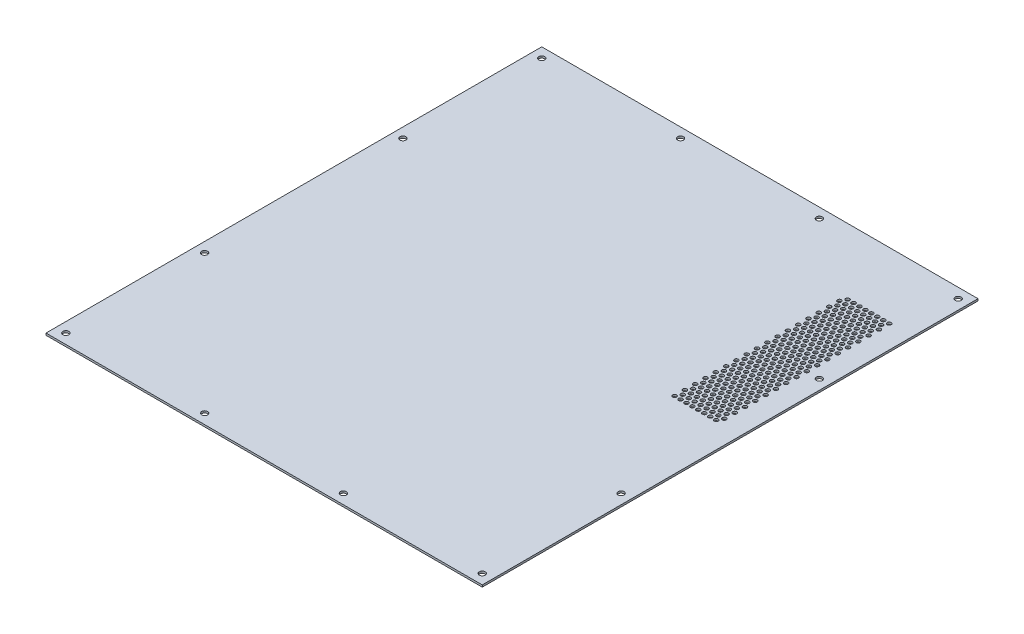
from build123d import *

# Parameters (mm, degrees)
SKETCH1_W           = 440
SKETCH1_H           = 500
SKETCH1_R           = 2
SKETCH1_R_2         = 3
BOSS_EXTRUDE1_DEPTH = 2


with BuildPart() as part:
    # Sketch1 → Boss-Extrude1 (new body)
    with BuildSketch(Plane(origin=(0, 0, 0), x_dir=(1, 0, 0), z_dir=(0, 1, 0))):
        with Locations((220, 250)):
            Rectangle(SKETCH1_W, SKETCH1_H)
        with Locations(Location((372, 262, 0), (0, 0, 270))):
            Circle(SKETCH1_R, mode=Mode.SUBTRACT)
        with Locations(Location((375, 267.196152423, 0), (0, 0, 270))):
            Circle(SKETCH1_R, mode=Mode.SUBTRACT)
        with Locations(Location((381, 267.196152423, 0), (0, 0, 270))):
            Circle(SKETCH1_R, mode=Mode.SUBTRACT)
        with Locations(Location((378, 262, 0), (0, 0, 270))):
            Circle(SKETCH1_R, mode=Mode.SUBTRACT)
        with Locations(Location((387, 267.196152423, 0), (0, 0, 270))):
            Circle(SKETCH1_R, mode=Mode.SUBTRACT)
        with Locations(Location((384, 262, 0), (0, 0, 270))):
            Circle(SKETCH1_R, mode=Mode.SUBTRACT)
        with Locations(Location((393, 267.196152423, 0), (0, 0, 270))):
            Circle(SKETCH1_R, mode=Mode.SUBTRACT)
        with Locations(Location((390, 262, 0), (0, 0, 270))):
            Circle(SKETCH1_R, mode=Mode.SUBTRACT)
        with Locations(Location((399, 267.196152423, 0), (0, 0, 270))):
            Circle(SKETCH1_R, mode=Mode.SUBTRACT)
        with Locations(Location((396, 262, 0), (0, 0, 270))):
            Circle(SKETCH1_R, mode=Mode.SUBTRACT)
        with Locations(Location((405, 267.196152423, 0), (0, 0, 270))):
            Circle(SKETCH1_R, mode=Mode.SUBTRACT)
        with Locations(Location((402, 262, 0), (0, 0, 270))):
            Circle(SKETCH1_R, mode=Mode.SUBTRACT)
        with Locations(Location((411, 267.196152423, 0), (0, 0, 270))):
            Circle(SKETCH1_R, mode=Mode.SUBTRACT)
        with Locations(Location((408, 262, 0), (0, 0, 270))):
            Circle(SKETCH1_R, mode=Mode.SUBTRACT)
        with Locations(Location((417, 267.196152423, 0), (0, 0, 270))):
            Circle(SKETCH1_R, mode=Mode.SUBTRACT)
        with Locations(Location((414, 262, 0), (0, 0, 270))):
            Circle(SKETCH1_R, mode=Mode.SUBTRACT)
        with Locations(Location((381, 277.586152423, 0), (0, 0, 270))):
            Circle(SKETCH1_R, mode=Mode.SUBTRACT)
        with Locations(Location((378, 272.39, 0), (0, 0, 270))):
            Circle(SKETCH1_R, mode=Mode.SUBTRACT)
        with Locations(Location((387, 277.586152423, 0), (0, 0, 270))):
            Circle(SKETCH1_R, mode=Mode.SUBTRACT)
        with Locations(Location((384, 272.39, 0), (0, 0, 270))):
            Circle(SKETCH1_R, mode=Mode.SUBTRACT)
        with Locations(Location((393, 277.586152423, 0), (0, 0, 270))):
            Circle(SKETCH1_R, mode=Mode.SUBTRACT)
        with Locations(Location((390, 272.39, 0), (0, 0, 270))):
            Circle(SKETCH1_R, mode=Mode.SUBTRACT)
        with Locations(Location((399, 277.586152423, 0), (0, 0, 270))):
            Circle(SKETCH1_R, mode=Mode.SUBTRACT)
        with Locations(Location((396, 272.39, 0), (0, 0, 270))):
            Circle(SKETCH1_R, mode=Mode.SUBTRACT)
        with Locations(Location((405, 277.586152423, 0), (0, 0, 270))):
            Circle(SKETCH1_R, mode=Mode.SUBTRACT)
        with Locations(Location((402, 272.39, 0), (0, 0, 270))):
            Circle(SKETCH1_R, mode=Mode.SUBTRACT)
        with Locations(Location((411, 277.586152423, 0), (0, 0, 270))):
            Circle(SKETCH1_R, mode=Mode.SUBTRACT)
        with Locations(Location((408, 272.39, 0), (0, 0, 270))):
            Circle(SKETCH1_R, mode=Mode.SUBTRACT)
        with Locations(Location((417, 277.586152423, 0), (0, 0, 270))):
            Circle(SKETCH1_R, mode=Mode.SUBTRACT)
        with Locations(Location((414, 272.39, 0), (0, 0, 270))):
            Circle(SKETCH1_R, mode=Mode.SUBTRACT)
        with Locations(Location((381, 287.976152423, 0), (0, 0, 270))):
            Circle(SKETCH1_R, mode=Mode.SUBTRACT)
        with Locations(Location((378, 282.78, 0), (0, 0, 270))):
            Circle(SKETCH1_R, mode=Mode.SUBTRACT)
        with Locations(Location((387, 287.976152423, 0), (0, 0, 270))):
            Circle(SKETCH1_R, mode=Mode.SUBTRACT)
        with Locations(Location((384, 282.78, 0), (0, 0, 270))):
            Circle(SKETCH1_R, mode=Mode.SUBTRACT)
        with Locations(Location((393, 287.976152423, 0), (0, 0, 270))):
            Circle(SKETCH1_R, mode=Mode.SUBTRACT)
        with Locations(Location((390, 282.78, 0), (0, 0, 270))):
            Circle(SKETCH1_R, mode=Mode.SUBTRACT)
        with Locations(Location((399, 287.976152423, 0), (0, 0, 270))):
            Circle(SKETCH1_R, mode=Mode.SUBTRACT)
        with Locations(Location((396, 282.78, 0), (0, 0, 270))):
            Circle(SKETCH1_R, mode=Mode.SUBTRACT)
        with Locations(Location((405, 287.976152423, 0), (0, 0, 270))):
            Circle(SKETCH1_R, mode=Mode.SUBTRACT)
        with Locations(Location((402, 282.78, 0), (0, 0, 270))):
            Circle(SKETCH1_R, mode=Mode.SUBTRACT)
        with Locations(Location((411, 287.976152423, 0), (0, 0, 270))):
            Circle(SKETCH1_R, mode=Mode.SUBTRACT)
        with Locations(Location((408, 282.78, 0), (0, 0, 270))):
            Circle(SKETCH1_R, mode=Mode.SUBTRACT)
        with Locations(Location((417, 287.976152423, 0), (0, 0, 270))):
            Circle(SKETCH1_R, mode=Mode.SUBTRACT)
        with Locations(Location((414, 282.78, 0), (0, 0, 270))):
            Circle(SKETCH1_R, mode=Mode.SUBTRACT)
        with Locations(Location((381, 298.366152423, 0), (0, 0, 270))):
            Circle(SKETCH1_R, mode=Mode.SUBTRACT)
        with Locations(Location((378, 293.17, 0), (0, 0, 270))):
            Circle(SKETCH1_R, mode=Mode.SUBTRACT)
        with Locations(Location((387, 298.366152423, 0), (0, 0, 270))):
            Circle(SKETCH1_R, mode=Mode.SUBTRACT)
        with Locations(Location((384, 293.17, 0), (0, 0, 270))):
            Circle(SKETCH1_R, mode=Mode.SUBTRACT)
        with Locations(Location((393, 298.366152423, 0), (0, 0, 270))):
            Circle(SKETCH1_R, mode=Mode.SUBTRACT)
        with Locations(Location((390, 293.17, 0), (0, 0, 270))):
            Circle(SKETCH1_R, mode=Mode.SUBTRACT)
        with Locations(Location((399, 298.366152423, 0), (0, 0, 270))):
            Circle(SKETCH1_R, mode=Mode.SUBTRACT)
        with Locations(Location((396, 293.17, 0), (0, 0, 270))):
            Circle(SKETCH1_R, mode=Mode.SUBTRACT)
        with Locations(Location((405, 298.366152423, 0), (0, 0, 270))):
            Circle(SKETCH1_R, mode=Mode.SUBTRACT)
        with Locations(Location((402, 293.17, 0), (0, 0, 270))):
            Circle(SKETCH1_R, mode=Mode.SUBTRACT)
        with Locations(Location((411, 298.366152423, 0), (0, 0, 270))):
            Circle(SKETCH1_R, mode=Mode.SUBTRACT)
        with Locations(Location((408, 293.17, 0), (0, 0, 270))):
            Circle(SKETCH1_R, mode=Mode.SUBTRACT)
        with Locations(Location((417, 298.366152423, 0), (0, 0, 270))):
            Circle(SKETCH1_R, mode=Mode.SUBTRACT)
        with Locations(Location((414, 293.17, 0), (0, 0, 270))):
            Circle(SKETCH1_R, mode=Mode.SUBTRACT)
        with Locations(Location((381, 308.756152423, 0), (0, 0, 270))):
            Circle(SKETCH1_R, mode=Mode.SUBTRACT)
        with Locations(Location((378, 303.56, 0), (0, 0, 270))):
            Circle(SKETCH1_R, mode=Mode.SUBTRACT)
        with Locations(Location((387, 308.756152423, 0), (0, 0, 270))):
            Circle(SKETCH1_R, mode=Mode.SUBTRACT)
        with Locations(Location((384, 303.56, 0), (0, 0, 270))):
            Circle(SKETCH1_R, mode=Mode.SUBTRACT)
        with Locations(Location((393, 308.756152423, 0), (0, 0, 270))):
            Circle(SKETCH1_R, mode=Mode.SUBTRACT)
        with Locations(Location((390, 303.56, 0), (0, 0, 270))):
            Circle(SKETCH1_R, mode=Mode.SUBTRACT)
        with Locations(Location((399, 308.756152423, 0), (0, 0, 270))):
            Circle(SKETCH1_R, mode=Mode.SUBTRACT)
        with Locations(Location((396, 303.56, 0), (0, 0, 270))):
            Circle(SKETCH1_R, mode=Mode.SUBTRACT)
        with Locations(Location((405, 308.756152423, 0), (0, 0, 270))):
            Circle(SKETCH1_R, mode=Mode.SUBTRACT)
        with Locations(Location((402, 303.56, 0), (0, 0, 270))):
            Circle(SKETCH1_R, mode=Mode.SUBTRACT)
        with Locations(Location((411, 308.756152423, 0), (0, 0, 270))):
            Circle(SKETCH1_R, mode=Mode.SUBTRACT)
        with Locations(Location((408, 303.56, 0), (0, 0, 270))):
            Circle(SKETCH1_R, mode=Mode.SUBTRACT)
        with Locations(Location((417, 308.756152423, 0), (0, 0, 270))):
            Circle(SKETCH1_R, mode=Mode.SUBTRACT)
        with Locations(Location((414, 303.56, 0), (0, 0, 270))):
            Circle(SKETCH1_R, mode=Mode.SUBTRACT)
        with Locations(Location((381, 319.146152423, 0), (0, 0, 270))):
            Circle(SKETCH1_R, mode=Mode.SUBTRACT)
        with Locations(Location((378, 313.95, 0), (0, 0, 270))):
            Circle(SKETCH1_R, mode=Mode.SUBTRACT)
        with Locations(Location((387, 319.146152423, 0), (0, 0, 270))):
            Circle(SKETCH1_R, mode=Mode.SUBTRACT)
        with Locations(Location((384, 313.95, 0), (0, 0, 270))):
            Circle(SKETCH1_R, mode=Mode.SUBTRACT)
        with Locations(Location((393, 319.146152423, 0), (0, 0, 270))):
            Circle(SKETCH1_R, mode=Mode.SUBTRACT)
        with Locations(Location((390, 313.95, 0), (0, 0, 270))):
            Circle(SKETCH1_R, mode=Mode.SUBTRACT)
        with Locations(Location((399, 319.146152423, 0), (0, 0, 270))):
            Circle(SKETCH1_R, mode=Mode.SUBTRACT)
        with Locations(Location((396, 313.95, 0), (0, 0, 270))):
            Circle(SKETCH1_R, mode=Mode.SUBTRACT)
        with Locations(Location((405, 319.146152423, 0), (0, 0, 270))):
            Circle(SKETCH1_R, mode=Mode.SUBTRACT)
        with Locations(Location((402, 313.95, 0), (0, 0, 270))):
            Circle(SKETCH1_R, mode=Mode.SUBTRACT)
        with Locations(Location((411, 319.146152423, 0), (0, 0, 270))):
            Circle(SKETCH1_R, mode=Mode.SUBTRACT)
        with Locations(Location((408, 313.95, 0), (0, 0, 270))):
            Circle(SKETCH1_R, mode=Mode.SUBTRACT)
        with Locations(Location((417, 319.146152423, 0), (0, 0, 270))):
            Circle(SKETCH1_R, mode=Mode.SUBTRACT)
        with Locations(Location((414, 313.95, 0), (0, 0, 270))):
            Circle(SKETCH1_R, mode=Mode.SUBTRACT)
        with Locations(Location((381, 329.536152423, 0), (0, 0, 270))):
            Circle(SKETCH1_R, mode=Mode.SUBTRACT)
        with Locations(Location((378, 324.34, 0), (0, 0, 270))):
            Circle(SKETCH1_R, mode=Mode.SUBTRACT)
        with Locations(Location((387, 329.536152423, 0), (0, 0, 270))):
            Circle(SKETCH1_R, mode=Mode.SUBTRACT)
        with Locations(Location((384, 324.34, 0), (0, 0, 270))):
            Circle(SKETCH1_R, mode=Mode.SUBTRACT)
        with Locations(Location((393, 329.536152423, 0), (0, 0, 270))):
            Circle(SKETCH1_R, mode=Mode.SUBTRACT)
        with Locations(Location((390, 324.34, 0), (0, 0, 270))):
            Circle(SKETCH1_R, mode=Mode.SUBTRACT)
        with Locations(Location((399, 329.536152423, 0), (0, 0, 270))):
            Circle(SKETCH1_R, mode=Mode.SUBTRACT)
        with Locations(Location((396, 324.34, 0), (0, 0, 270))):
            Circle(SKETCH1_R, mode=Mode.SUBTRACT)
        with Locations(Location((405, 329.536152423, 0), (0, 0, 270))):
            Circle(SKETCH1_R, mode=Mode.SUBTRACT)
        with Locations(Location((402, 324.34, 0), (0, 0, 270))):
            Circle(SKETCH1_R, mode=Mode.SUBTRACT)
        with Locations(Location((411, 329.536152423, 0), (0, 0, 270))):
            Circle(SKETCH1_R, mode=Mode.SUBTRACT)
        with Locations(Location((408, 324.34, 0), (0, 0, 270))):
            Circle(SKETCH1_R, mode=Mode.SUBTRACT)
        with Locations(Location((417, 329.536152423, 0), (0, 0, 270))):
            Circle(SKETCH1_R, mode=Mode.SUBTRACT)
        with Locations(Location((414, 324.34, 0), (0, 0, 270))):
            Circle(SKETCH1_R, mode=Mode.SUBTRACT)
        with Locations(Location((381, 339.926152423, 0), (0, 0, 270))):
            Circle(SKETCH1_R, mode=Mode.SUBTRACT)
        with Locations(Location((378, 334.73, 0), (0, 0, 270))):
            Circle(SKETCH1_R, mode=Mode.SUBTRACT)
        with Locations(Location((387, 339.926152423, 0), (0, 0, 270))):
            Circle(SKETCH1_R, mode=Mode.SUBTRACT)
        with Locations(Location((384, 334.73, 0), (0, 0, 270))):
            Circle(SKETCH1_R, mode=Mode.SUBTRACT)
        with Locations(Location((393, 339.926152423, 0), (0, 0, 270))):
            Circle(SKETCH1_R, mode=Mode.SUBTRACT)
        with Locations(Location((390, 334.73, 0), (0, 0, 270))):
            Circle(SKETCH1_R, mode=Mode.SUBTRACT)
        with Locations(Location((399, 339.926152423, 0), (0, 0, 270))):
            Circle(SKETCH1_R, mode=Mode.SUBTRACT)
        with Locations(Location((396, 334.73, 0), (0, 0, 270))):
            Circle(SKETCH1_R, mode=Mode.SUBTRACT)
        with Locations(Location((405, 339.926152423, 0), (0, 0, 270))):
            Circle(SKETCH1_R, mode=Mode.SUBTRACT)
        with Locations(Location((402, 334.73, 0), (0, 0, 270))):
            Circle(SKETCH1_R, mode=Mode.SUBTRACT)
        with Locations(Location((411, 339.926152423, 0), (0, 0, 270))):
            Circle(SKETCH1_R, mode=Mode.SUBTRACT)
        with Locations(Location((408, 334.73, 0), (0, 0, 270))):
            Circle(SKETCH1_R, mode=Mode.SUBTRACT)
        with Locations(Location((417, 339.926152423, 0), (0, 0, 270))):
            Circle(SKETCH1_R, mode=Mode.SUBTRACT)
        with Locations(Location((414, 334.73, 0), (0, 0, 270))):
            Circle(SKETCH1_R, mode=Mode.SUBTRACT)
        with Locations(Location((381, 350.316152423, 0), (0, 0, 270))):
            Circle(SKETCH1_R, mode=Mode.SUBTRACT)
        with Locations(Location((378, 345.12, 0), (0, 0, 270))):
            Circle(SKETCH1_R, mode=Mode.SUBTRACT)
        with Locations(Location((387, 350.316152423, 0), (0, 0, 270))):
            Circle(SKETCH1_R, mode=Mode.SUBTRACT)
        with Locations(Location((384, 345.12, 0), (0, 0, 270))):
            Circle(SKETCH1_R, mode=Mode.SUBTRACT)
        with Locations(Location((393, 350.316152423, 0), (0, 0, 270))):
            Circle(SKETCH1_R, mode=Mode.SUBTRACT)
        with Locations(Location((390, 345.12, 0), (0, 0, 270))):
            Circle(SKETCH1_R, mode=Mode.SUBTRACT)
        with Locations(Location((399, 350.316152423, 0), (0, 0, 270))):
            Circle(SKETCH1_R, mode=Mode.SUBTRACT)
        with Locations(Location((396, 345.12, 0), (0, 0, 270))):
            Circle(SKETCH1_R, mode=Mode.SUBTRACT)
        with Locations(Location((405, 350.316152423, 0), (0, 0, 270))):
            Circle(SKETCH1_R, mode=Mode.SUBTRACT)
        with Locations(Location((402, 345.12, 0), (0, 0, 270))):
            Circle(SKETCH1_R, mode=Mode.SUBTRACT)
        with Locations(Location((411, 350.316152423, 0), (0, 0, 270))):
            Circle(SKETCH1_R, mode=Mode.SUBTRACT)
        with Locations(Location((408, 345.12, 0), (0, 0, 270))):
            Circle(SKETCH1_R, mode=Mode.SUBTRACT)
        with Locations(Location((417, 350.316152423, 0), (0, 0, 270))):
            Circle(SKETCH1_R, mode=Mode.SUBTRACT)
        with Locations(Location((414, 345.12, 0), (0, 0, 270))):
            Circle(SKETCH1_R, mode=Mode.SUBTRACT)
        with Locations(Location((381, 360.706152423, 0), (0, 0, 270))):
            Circle(SKETCH1_R, mode=Mode.SUBTRACT)
        with Locations(Location((378, 355.51, 0), (0, 0, 270))):
            Circle(SKETCH1_R, mode=Mode.SUBTRACT)
        with Locations(Location((387, 360.706152423, 0), (0, 0, 270))):
            Circle(SKETCH1_R, mode=Mode.SUBTRACT)
        with Locations(Location((384, 355.51, 0), (0, 0, 270))):
            Circle(SKETCH1_R, mode=Mode.SUBTRACT)
        with Locations(Location((393, 360.706152423, 0), (0, 0, 270))):
            Circle(SKETCH1_R, mode=Mode.SUBTRACT)
        with Locations(Location((390, 355.51, 0), (0, 0, 270))):
            Circle(SKETCH1_R, mode=Mode.SUBTRACT)
        with Locations(Location((399, 360.706152423, 0), (0, 0, 270))):
            Circle(SKETCH1_R, mode=Mode.SUBTRACT)
        with Locations(Location((396, 355.51, 0), (0, 0, 270))):
            Circle(SKETCH1_R, mode=Mode.SUBTRACT)
        with Locations(Location((405, 360.706152423, 0), (0, 0, 270))):
            Circle(SKETCH1_R, mode=Mode.SUBTRACT)
        with Locations(Location((402, 355.51, 0), (0, 0, 270))):
            Circle(SKETCH1_R, mode=Mode.SUBTRACT)
        with Locations(Location((411, 360.706152423, 0), (0, 0, 270))):
            Circle(SKETCH1_R, mode=Mode.SUBTRACT)
        with Locations(Location((408, 355.51, 0), (0, 0, 270))):
            Circle(SKETCH1_R, mode=Mode.SUBTRACT)
        with Locations(Location((417, 360.706152423, 0), (0, 0, 270))):
            Circle(SKETCH1_R, mode=Mode.SUBTRACT)
        with Locations(Location((414, 355.51, 0), (0, 0, 270))):
            Circle(SKETCH1_R, mode=Mode.SUBTRACT)
        with Locations(Location((381, 371.096152423, 0), (0, 0, 270))):
            Circle(SKETCH1_R, mode=Mode.SUBTRACT)
        with Locations(Location((378, 365.9, 0), (0, 0, 270))):
            Circle(SKETCH1_R, mode=Mode.SUBTRACT)
        with Locations(Location((387, 371.096152423, 0), (0, 0, 270))):
            Circle(SKETCH1_R, mode=Mode.SUBTRACT)
        with Locations(Location((384, 365.9, 0), (0, 0, 270))):
            Circle(SKETCH1_R, mode=Mode.SUBTRACT)
        with Locations(Location((393, 371.096152423, 0), (0, 0, 270))):
            Circle(SKETCH1_R, mode=Mode.SUBTRACT)
        with Locations(Location((390, 365.9, 0), (0, 0, 270))):
            Circle(SKETCH1_R, mode=Mode.SUBTRACT)
        with Locations(Location((399, 371.096152423, 0), (0, 0, 270))):
            Circle(SKETCH1_R, mode=Mode.SUBTRACT)
        with Locations(Location((396, 365.9, 0), (0, 0, 270))):
            Circle(SKETCH1_R, mode=Mode.SUBTRACT)
        with Locations(Location((405, 371.096152423, 0), (0, 0, 270))):
            Circle(SKETCH1_R, mode=Mode.SUBTRACT)
        with Locations(Location((402, 365.9, 0), (0, 0, 270))):
            Circle(SKETCH1_R, mode=Mode.SUBTRACT)
        with Locations(Location((411, 371.096152423, 0), (0, 0, 270))):
            Circle(SKETCH1_R, mode=Mode.SUBTRACT)
        with Locations(Location((408, 365.9, 0), (0, 0, 270))):
            Circle(SKETCH1_R, mode=Mode.SUBTRACT)
        with Locations(Location((417, 371.096152423, 0), (0, 0, 270))):
            Circle(SKETCH1_R, mode=Mode.SUBTRACT)
        with Locations(Location((414, 365.9, 0), (0, 0, 270))):
            Circle(SKETCH1_R, mode=Mode.SUBTRACT)
        with Locations(Location((381, 381.486152423, 0), (0, 0, 270))):
            Circle(SKETCH1_R, mode=Mode.SUBTRACT)
        with Locations(Location((378, 376.29, 0), (0, 0, 270))):
            Circle(SKETCH1_R, mode=Mode.SUBTRACT)
        with Locations(Location((387, 381.486152423, 0), (0, 0, 270))):
            Circle(SKETCH1_R, mode=Mode.SUBTRACT)
        with Locations(Location((384, 376.29, 0), (0, 0, 270))):
            Circle(SKETCH1_R, mode=Mode.SUBTRACT)
        with Locations(Location((393, 381.486152423, 0), (0, 0, 270))):
            Circle(SKETCH1_R, mode=Mode.SUBTRACT)
        with Locations(Location((390, 376.29, 0), (0, 0, 270))):
            Circle(SKETCH1_R, mode=Mode.SUBTRACT)
        with Locations(Location((399, 381.486152423, 0), (0, 0, 270))):
            Circle(SKETCH1_R, mode=Mode.SUBTRACT)
        with Locations(Location((396, 376.29, 0), (0, 0, 270))):
            Circle(SKETCH1_R, mode=Mode.SUBTRACT)
        with Locations(Location((405, 381.486152423, 0), (0, 0, 270))):
            Circle(SKETCH1_R, mode=Mode.SUBTRACT)
        with Locations(Location((402, 376.29, 0), (0, 0, 270))):
            Circle(SKETCH1_R, mode=Mode.SUBTRACT)
        with Locations(Location((411, 381.486152423, 0), (0, 0, 270))):
            Circle(SKETCH1_R, mode=Mode.SUBTRACT)
        with Locations(Location((408, 376.29, 0), (0, 0, 270))):
            Circle(SKETCH1_R, mode=Mode.SUBTRACT)
        with Locations(Location((417, 381.486152423, 0), (0, 0, 270))):
            Circle(SKETCH1_R, mode=Mode.SUBTRACT)
        with Locations(Location((414, 376.29, 0), (0, 0, 270))):
            Circle(SKETCH1_R, mode=Mode.SUBTRACT)
        with Locations(Location((381, 391.876152423, 0), (0, 0, 270))):
            Circle(SKETCH1_R, mode=Mode.SUBTRACT)
        with Locations(Location((378, 386.68, 0), (0, 0, 270))):
            Circle(SKETCH1_R, mode=Mode.SUBTRACT)
        with Locations(Location((387, 391.876152423, 0), (0, 0, 270))):
            Circle(SKETCH1_R, mode=Mode.SUBTRACT)
        with Locations(Location((384, 386.68, 0), (0, 0, 270))):
            Circle(SKETCH1_R, mode=Mode.SUBTRACT)
        with Locations(Location((393, 391.876152423, 0), (0, 0, 270))):
            Circle(SKETCH1_R, mode=Mode.SUBTRACT)
        with Locations(Location((390, 386.68, 0), (0, 0, 270))):
            Circle(SKETCH1_R, mode=Mode.SUBTRACT)
        with Locations(Location((399, 391.876152423, 0), (0, 0, 270))):
            Circle(SKETCH1_R, mode=Mode.SUBTRACT)
        with Locations(Location((396, 386.68, 0), (0, 0, 270))):
            Circle(SKETCH1_R, mode=Mode.SUBTRACT)
        with Locations(Location((405, 391.876152423, 0), (0, 0, 270))):
            Circle(SKETCH1_R, mode=Mode.SUBTRACT)
        with Locations(Location((402, 386.68, 0), (0, 0, 270))):
            Circle(SKETCH1_R, mode=Mode.SUBTRACT)
        with Locations(Location((411, 391.876152423, 0), (0, 0, 270))):
            Circle(SKETCH1_R, mode=Mode.SUBTRACT)
        with Locations(Location((408, 386.68, 0), (0, 0, 270))):
            Circle(SKETCH1_R, mode=Mode.SUBTRACT)
        with Locations(Location((417, 391.876152423, 0), (0, 0, 270))):
            Circle(SKETCH1_R, mode=Mode.SUBTRACT)
        with Locations(Location((414, 386.68, 0), (0, 0, 270))):
            Circle(SKETCH1_R, mode=Mode.SUBTRACT)
        with Locations(Location((381, 402.266152423, 0), (0, 0, 270))):
            Circle(SKETCH1_R, mode=Mode.SUBTRACT)
        with Locations(Location((378, 397.07, 0), (0, 0, 270))):
            Circle(SKETCH1_R, mode=Mode.SUBTRACT)
        with Locations(Location((387, 402.266152423, 0), (0, 0, 270))):
            Circle(SKETCH1_R, mode=Mode.SUBTRACT)
        with Locations(Location((384, 397.07, 0), (0, 0, 270))):
            Circle(SKETCH1_R, mode=Mode.SUBTRACT)
        with Locations(Location((393, 402.266152423, 0), (0, 0, 270))):
            Circle(SKETCH1_R, mode=Mode.SUBTRACT)
        with Locations(Location((390, 397.07, 0), (0, 0, 270))):
            Circle(SKETCH1_R, mode=Mode.SUBTRACT)
        with Locations(Location((399, 402.266152423, 0), (0, 0, 270))):
            Circle(SKETCH1_R, mode=Mode.SUBTRACT)
        with Locations(Location((396, 397.07, 0), (0, 0, 270))):
            Circle(SKETCH1_R, mode=Mode.SUBTRACT)
        with Locations(Location((405, 402.266152423, 0), (0, 0, 270))):
            Circle(SKETCH1_R, mode=Mode.SUBTRACT)
        with Locations(Location((402, 397.07, 0), (0, 0, 270))):
            Circle(SKETCH1_R, mode=Mode.SUBTRACT)
        with Locations(Location((411, 402.266152423, 0), (0, 0, 270))):
            Circle(SKETCH1_R, mode=Mode.SUBTRACT)
        with Locations(Location((408, 397.07, 0), (0, 0, 270))):
            Circle(SKETCH1_R, mode=Mode.SUBTRACT)
        with Locations(Location((417, 402.266152423, 0), (0, 0, 270))):
            Circle(SKETCH1_R, mode=Mode.SUBTRACT)
        with Locations(Location((414, 397.07, 0), (0, 0, 270))):
            Circle(SKETCH1_R, mode=Mode.SUBTRACT)
        with Locations(Location((381, 412.656152423, 0), (0, 0, 270))):
            Circle(SKETCH1_R, mode=Mode.SUBTRACT)
        with Locations(Location((378, 407.46, 0), (0, 0, 270))):
            Circle(SKETCH1_R, mode=Mode.SUBTRACT)
        with Locations(Location((387, 412.656152423, 0), (0, 0, 270))):
            Circle(SKETCH1_R, mode=Mode.SUBTRACT)
        with Locations(Location((384, 407.46, 0), (0, 0, 270))):
            Circle(SKETCH1_R, mode=Mode.SUBTRACT)
        with Locations(Location((393, 412.656152423, 0), (0, 0, 270))):
            Circle(SKETCH1_R, mode=Mode.SUBTRACT)
        with Locations(Location((390, 407.46, 0), (0, 0, 270))):
            Circle(SKETCH1_R, mode=Mode.SUBTRACT)
        with Locations(Location((399, 412.656152423, 0), (0, 0, 270))):
            Circle(SKETCH1_R, mode=Mode.SUBTRACT)
        with Locations(Location((396, 407.46, 0), (0, 0, 270))):
            Circle(SKETCH1_R, mode=Mode.SUBTRACT)
        with Locations(Location((405, 412.656152423, 0), (0, 0, 270))):
            Circle(SKETCH1_R, mode=Mode.SUBTRACT)
        with Locations(Location((402, 407.46, 0), (0, 0, 270))):
            Circle(SKETCH1_R, mode=Mode.SUBTRACT)
        with Locations(Location((411, 412.656152423, 0), (0, 0, 270))):
            Circle(SKETCH1_R, mode=Mode.SUBTRACT)
        with Locations(Location((408, 407.46, 0), (0, 0, 270))):
            Circle(SKETCH1_R, mode=Mode.SUBTRACT)
        with Locations(Location((417, 412.656152423, 0), (0, 0, 270))):
            Circle(SKETCH1_R, mode=Mode.SUBTRACT)
        with Locations(Location((414, 407.46, 0), (0, 0, 270))):
            Circle(SKETCH1_R, mode=Mode.SUBTRACT)
        with Locations(Location((381, 423.046152423, 0), (0, 0, 270))):
            Circle(SKETCH1_R, mode=Mode.SUBTRACT)
        with Locations(Location((378, 417.85, 0), (0, 0, 270))):
            Circle(SKETCH1_R, mode=Mode.SUBTRACT)
        with Locations(Location((387, 423.046152423, 0), (0, 0, 270))):
            Circle(SKETCH1_R, mode=Mode.SUBTRACT)
        with Locations(Location((384, 417.85, 0), (0, 0, 270))):
            Circle(SKETCH1_R, mode=Mode.SUBTRACT)
        with Locations(Location((393, 423.046152423, 0), (0, 0, 270))):
            Circle(SKETCH1_R, mode=Mode.SUBTRACT)
        with Locations(Location((390, 417.85, 0), (0, 0, 270))):
            Circle(SKETCH1_R, mode=Mode.SUBTRACT)
        with Locations(Location((399, 423.046152423, 0), (0, 0, 270))):
            Circle(SKETCH1_R, mode=Mode.SUBTRACT)
        with Locations(Location((396, 417.85, 0), (0, 0, 270))):
            Circle(SKETCH1_R, mode=Mode.SUBTRACT)
        with Locations(Location((405, 423.046152423, 0), (0, 0, 270))):
            Circle(SKETCH1_R, mode=Mode.SUBTRACT)
        with Locations(Location((402, 417.85, 0), (0, 0, 270))):
            Circle(SKETCH1_R, mode=Mode.SUBTRACT)
        with Locations(Location((411, 423.046152423, 0), (0, 0, 270))):
            Circle(SKETCH1_R, mode=Mode.SUBTRACT)
        with Locations(Location((408, 417.85, 0), (0, 0, 270))):
            Circle(SKETCH1_R, mode=Mode.SUBTRACT)
        with Locations(Location((417, 423.046152423, 0), (0, 0, 270))):
            Circle(SKETCH1_R, mode=Mode.SUBTRACT)
        with Locations(Location((414, 417.85, 0), (0, 0, 270))):
            Circle(SKETCH1_R, mode=Mode.SUBTRACT)
        with Locations(Location((381, 433.436152423, 0), (0, 0, 270))):
            Circle(SKETCH1_R, mode=Mode.SUBTRACT)
        with Locations(Location((378, 428.24, 0), (0, 0, 270))):
            Circle(SKETCH1_R, mode=Mode.SUBTRACT)
        with Locations(Location((387, 433.436152423, 0), (0, 0, 270))):
            Circle(SKETCH1_R, mode=Mode.SUBTRACT)
        with Locations(Location((384, 428.24, 0), (0, 0, 270))):
            Circle(SKETCH1_R, mode=Mode.SUBTRACT)
        with Locations(Location((393, 433.436152423, 0), (0, 0, 270))):
            Circle(SKETCH1_R, mode=Mode.SUBTRACT)
        with Locations(Location((390, 428.24, 0), (0, 0, 270))):
            Circle(SKETCH1_R, mode=Mode.SUBTRACT)
        with Locations(Location((399, 433.436152423, 0), (0, 0, 270))):
            Circle(SKETCH1_R, mode=Mode.SUBTRACT)
        with Locations(Location((396, 428.24, 0), (0, 0, 270))):
            Circle(SKETCH1_R, mode=Mode.SUBTRACT)
        with Locations(Location((405, 433.436152423, 0), (0, 0, 270))):
            Circle(SKETCH1_R, mode=Mode.SUBTRACT)
        with Locations(Location((402, 428.24, 0), (0, 0, 270))):
            Circle(SKETCH1_R, mode=Mode.SUBTRACT)
        with Locations(Location((411, 433.436152423, 0), (0, 0, 270))):
            Circle(SKETCH1_R, mode=Mode.SUBTRACT)
        with Locations(Location((408, 428.24, 0), (0, 0, 270))):
            Circle(SKETCH1_R, mode=Mode.SUBTRACT)
        with Locations(Location((417, 433.436152423, 0), (0, 0, 270))):
            Circle(SKETCH1_R, mode=Mode.SUBTRACT)
        with Locations(Location((414, 428.24, 0), (0, 0, 270))):
            Circle(SKETCH1_R, mode=Mode.SUBTRACT)
        with Locations(Location((375, 277.586152423, 0), (0, 0, 270))):
            Circle(SKETCH1_R, mode=Mode.SUBTRACT)
        with Locations(Location((372, 272.39, 0), (0, 0, 270))):
            Circle(SKETCH1_R, mode=Mode.SUBTRACT)
        with Locations(Location((375, 287.976152423, 0), (0, 0, 270))):
            Circle(SKETCH1_R, mode=Mode.SUBTRACT)
        with Locations(Location((372, 282.78, 0), (0, 0, 270))):
            Circle(SKETCH1_R, mode=Mode.SUBTRACT)
        with Locations(Location((375, 298.366152423, 0), (0, 0, 270))):
            Circle(SKETCH1_R, mode=Mode.SUBTRACT)
        with Locations(Location((372, 293.17, 0), (0, 0, 270))):
            Circle(SKETCH1_R, mode=Mode.SUBTRACT)
        with Locations(Location((375, 308.756152423, 0), (0, 0, 270))):
            Circle(SKETCH1_R, mode=Mode.SUBTRACT)
        with Locations(Location((372, 303.56, 0), (0, 0, 270))):
            Circle(SKETCH1_R, mode=Mode.SUBTRACT)
        with Locations(Location((375, 319.146152423, 0), (0, 0, 270))):
            Circle(SKETCH1_R, mode=Mode.SUBTRACT)
        with Locations(Location((372, 313.95, 0), (0, 0, 270))):
            Circle(SKETCH1_R, mode=Mode.SUBTRACT)
        with Locations(Location((375, 329.536152423, 0), (0, 0, 270))):
            Circle(SKETCH1_R, mode=Mode.SUBTRACT)
        with Locations(Location((372, 324.34, 0), (0, 0, 270))):
            Circle(SKETCH1_R, mode=Mode.SUBTRACT)
        with Locations(Location((375, 339.926152423, 0), (0, 0, 270))):
            Circle(SKETCH1_R, mode=Mode.SUBTRACT)
        with Locations(Location((372, 334.73, 0), (0, 0, 270))):
            Circle(SKETCH1_R, mode=Mode.SUBTRACT)
        with Locations(Location((375, 350.316152423, 0), (0, 0, 270))):
            Circle(SKETCH1_R, mode=Mode.SUBTRACT)
        with Locations(Location((372, 345.12, 0), (0, 0, 270))):
            Circle(SKETCH1_R, mode=Mode.SUBTRACT)
        with Locations(Location((375, 360.706152423, 0), (0, 0, 270))):
            Circle(SKETCH1_R, mode=Mode.SUBTRACT)
        with Locations(Location((372, 355.51, 0), (0, 0, 270))):
            Circle(SKETCH1_R, mode=Mode.SUBTRACT)
        with Locations(Location((375, 371.096152423, 0), (0, 0, 270))):
            Circle(SKETCH1_R, mode=Mode.SUBTRACT)
        with Locations(Location((372, 365.9, 0), (0, 0, 270))):
            Circle(SKETCH1_R, mode=Mode.SUBTRACT)
        with Locations(Location((375, 381.486152423, 0), (0, 0, 270))):
            Circle(SKETCH1_R, mode=Mode.SUBTRACT)
        with Locations(Location((372, 376.29, 0), (0, 0, 270))):
            Circle(SKETCH1_R, mode=Mode.SUBTRACT)
        with Locations(Location((375, 391.876152423, 0), (0, 0, 270))):
            Circle(SKETCH1_R, mode=Mode.SUBTRACT)
        with Locations(Location((372, 386.68, 0), (0, 0, 270))):
            Circle(SKETCH1_R, mode=Mode.SUBTRACT)
        with Locations(Location((375, 402.266152423, 0), (0, 0, 270))):
            Circle(SKETCH1_R, mode=Mode.SUBTRACT)
        with Locations(Location((372, 397.07, 0), (0, 0, 270))):
            Circle(SKETCH1_R, mode=Mode.SUBTRACT)
        with Locations(Location((375, 412.656152423, 0), (0, 0, 270))):
            Circle(SKETCH1_R, mode=Mode.SUBTRACT)
        with Locations(Location((372, 407.46, 0), (0, 0, 270))):
            Circle(SKETCH1_R, mode=Mode.SUBTRACT)
        with Locations(Location((375, 423.046152423, 0), (0, 0, 270))):
            Circle(SKETCH1_R, mode=Mode.SUBTRACT)
        with Locations(Location((372, 417.85, 0), (0, 0, 270))):
            Circle(SKETCH1_R, mode=Mode.SUBTRACT)
        with Locations(Location((375, 433.436152423, 0), (0, 0, 270))):
            Circle(SKETCH1_R, mode=Mode.SUBTRACT)
        with Locations(Location((372, 428.24, 0), (0, 0, 270))):
            Circle(SKETCH1_R, mode=Mode.SUBTRACT)
        with Locations(Location((10, 490, 0), (0, 0, 270))):
            Circle(SKETCH1_R_2, mode=Mode.SUBTRACT)
        with Locations(Location((430, 490, 0), (0, 0, 270))):
            Circle(SKETCH1_R_2, mode=Mode.SUBTRACT)
        with Locations(Location((430, 10, 0), (0, 0, 270))):
            Circle(SKETCH1_R_2, mode=Mode.SUBTRACT)
        with Locations(Location((10, 10, 0), (0, 0, 270))):
            Circle(SKETCH1_R_2, mode=Mode.SUBTRACT)
        with Locations(Location((430, 150, 0), (0, 0, 270))):
            Circle(SKETCH1_R_2, mode=Mode.SUBTRACT)
        with Locations(Location((430, 350, 0), (0, 0, 270))):
            Circle(SKETCH1_R_2, mode=Mode.SUBTRACT)
        with Locations(Location((10, 150, 0), (0, 0, 270))):
            Circle(SKETCH1_R_2, mode=Mode.SUBTRACT)
        with Locations(Location((10, 350, 0), (0, 0, 270))):
            Circle(SKETCH1_R_2, mode=Mode.SUBTRACT)
        with Locations(Location((150, 10, 0), (0, 0, 270))):
            Circle(SKETCH1_R_2, mode=Mode.SUBTRACT)
        with Locations(Location((290, 10, 0), (0, 0, 270))):
            Circle(SKETCH1_R_2, mode=Mode.SUBTRACT)
        with Locations(Location((150, 490, 0), (0, 0, 270))):
            Circle(SKETCH1_R_2, mode=Mode.SUBTRACT)
        with Locations(Location((290, 490, 0), (0, 0, 270))):
            Circle(SKETCH1_R_2, mode=Mode.SUBTRACT)
    extrude(amount=BOSS_EXTRUDE1_DEPTH)


solid = part.part
